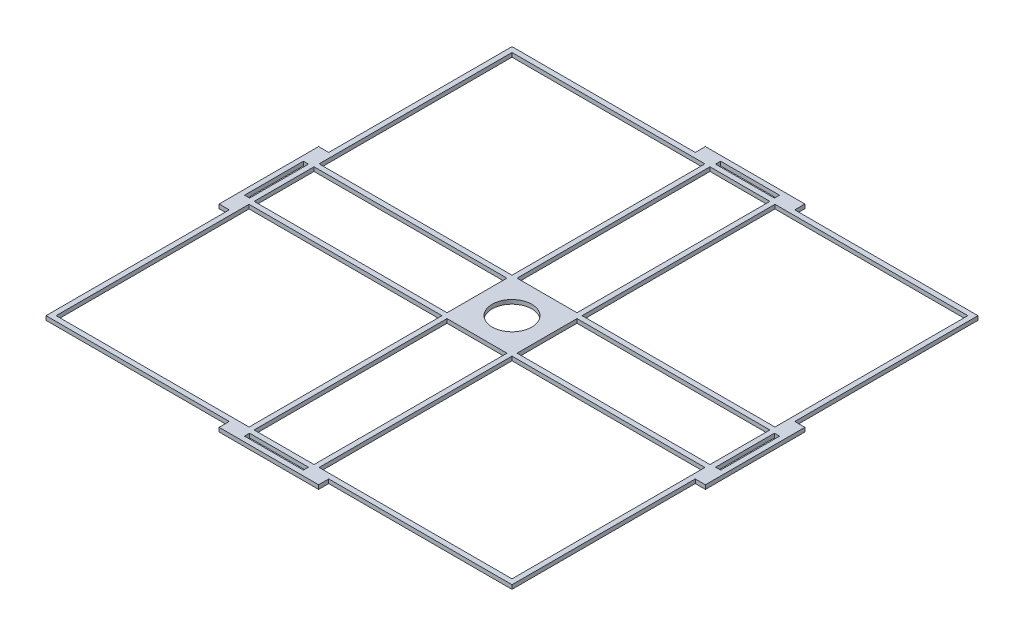
from build123d import *

# Parameters (mm, degrees)
SKETCH1_W           = 22.95
SKETCH1_H           = 22.95
SKETCH1_W_2         = 22.45
SKETCH1_H_2         = 22.45
SKETCH1_W_3         = 0.25
SKETCH1_H_3         = 9.5
SKETCH1_W_4         = 9.5
SKETCH1_H_4         = 0.25
SKETCH1_R           = 0.975
SKETCH1_H_5         = 1
SKETCH1_W_5         = 1
BOSS_EXTRUDE5_DEPTH = 0.2


with BuildPart() as part:
    # Sketch1 → Boss-Extrude5 (new body)
    # profile 1 of 26: a face of its own
    with BuildSketch(Plane(origin=(0, 0, 0), x_dir=(1, 0, 0), z_dir=(0, 1, 0))):
        Rectangle(SKETCH1_W, SKETCH1_H)
        Rectangle(SKETCH1_W_2, SKETCH1_H_2, mode=Mode.SUBTRACT)
    # profile 2 of 26: a face of its own
    with BuildSketch(Plane(origin=(0, 0, 0), x_dir=(1, 0, 0), z_dir=(0, 1, 0))):
        with Locations((-1.6, -6.475)):
            Rectangle(SKETCH1_W_3, SKETCH1_H_3)
    # profile 3 of 26: a face of its own
    with BuildSketch(Plane(origin=(0, 0, 0), x_dir=(1, 0, 0), z_dir=(0, 1, 0))):
        with Locations((-6.475, -1.6)):
            Rectangle(SKETCH1_W_4, SKETCH1_H_4)
    # profile 4 of 26: a face of its own
    with BuildSketch(Plane(origin=(0, 0, 0), x_dir=(1, 0, 0), z_dir=(0, 1, 0))):
        Polygon((-1.475, -1.475), (-1.475, -1.725), (1.475, -1.725), (1.475, -1.475), (1.725, -1.475), (1.725, 1.475), (1.475, 1.475), (1.475, 1.725), (-1.475, 1.725), (-1.475, 1.475), (-1.725, 1.475), (-1.725, -1.475), align=None)
        with Locations(Location((0, 0, 0), (0, 0, 270))):
            Circle(SKETCH1_R, mode=Mode.SUBTRACT)
    # profile 5 of 26: a face of its own
    with BuildSketch(Plane(origin=(0, 0, 0), x_dir=(1, 0, 0), z_dir=(0, 1, 0))):
        with Locations((-1.6, -1.6)):
            Rectangle(SKETCH1_W_3, SKETCH1_H_4)
    # profile 6 of 26: a face of its own
    with BuildSketch(Plane(origin=(0, 0, 0), x_dir=(1, 0, 0), z_dir=(0, 1, 0))):
        with Locations((1.6, -1.6)):
            Rectangle(SKETCH1_W_3, SKETCH1_H_4)
    # profile 7 of 26: a face of its own
    with BuildSketch(Plane(origin=(0, 0, 0), x_dir=(1, 0, 0), z_dir=(0, 1, 0))):
        with Locations((6.475, -1.6)):
            Rectangle(SKETCH1_W_4, SKETCH1_H_4)
    # profile 8 of 26: a face of its own
    with BuildSketch(Plane(origin=(0, 0, 0), x_dir=(1, 0, 0), z_dir=(0, 1, 0))):
        with Locations((1.6, -6.475)):
            Rectangle(SKETCH1_W_3, SKETCH1_H_3)
    # profile 9 of 26: a face of its own
    with BuildSketch(Plane(origin=(0, 0, 0), x_dir=(1, 0, 0), z_dir=(0, 1, 0))):
        with Locations((1.6, 1.6)):
            Rectangle(SKETCH1_W_3, SKETCH1_H_4)
    # profile 10 of 26: a face of its own
    with BuildSketch(Plane(origin=(0, 0, 0), x_dir=(1, 0, 0), z_dir=(0, 1, 0))):
        with Locations((6.475, 1.6)):
            Rectangle(SKETCH1_W_4, SKETCH1_H_4)
    # profile 11 of 26: a face of its own
    with BuildSketch(Plane(origin=(0, 0, 0), x_dir=(1, 0, 0), z_dir=(0, 1, 0))):
        with Locations((1.6, 6.475)):
            Rectangle(SKETCH1_W_3, SKETCH1_H_3)
    # profile 12 of 26: a face of its own
    with BuildSketch(Plane(origin=(0, 0, 0), x_dir=(1, 0, 0), z_dir=(0, 1, 0))):
        with Locations((-1.6, 1.6)):
            Rectangle(SKETCH1_W_3, SKETCH1_H_4)
    # profile 13 of 26: a face of its own
    with BuildSketch(Plane(origin=(0, 0, 0), x_dir=(1, 0, 0), z_dir=(0, 1, 0))):
        with Locations((-6.475, 1.6)):
            Rectangle(SKETCH1_W_4, SKETCH1_H_4)
    # profile 14 of 26: a face of its own
    with BuildSketch(Plane(origin=(0, 0, 0), x_dir=(1, 0, 0), z_dir=(0, 1, 0))):
        with Locations((-1.6, 6.475)):
            Rectangle(SKETCH1_W_3, SKETCH1_H_3)
    # profile 15 of 26: a face of its own
    with BuildSketch(Plane(origin=(0, 0, 0), x_dir=(1, 0, 0), z_dir=(0, 1, 0))):
        with Locations((-11.6, -1.95)):
            Rectangle(SKETCH1_W_3, SKETCH1_H_5)
    # profile 16 of 26: a face of its own
    with BuildSketch(Plane(origin=(0, 0, 0), x_dir=(1, 0, 0), z_dir=(0, 1, 0))):
        with Locations((-11.6, 1.95)):
            Rectangle(SKETCH1_W_3, SKETCH1_H_5)
    # profile 17 of 26: a face of its own
    with BuildSketch(Plane(origin=(0, 0, 0), x_dir=(1, 0, 0), z_dir=(0, 1, 0))):
        with Locations((11.6, -1.95)):
            Rectangle(SKETCH1_W_3, SKETCH1_H_5)
    # profile 18 of 26: a face of its own
    with BuildSketch(Plane(origin=(0, 0, 0), x_dir=(1, 0, 0), z_dir=(0, 1, 0))):
        with Locations((11.6, 1.95)):
            Rectangle(SKETCH1_W_3, SKETCH1_H_5)
    # profile 19 of 26: a face of its own
    with BuildSketch(Plane(origin=(0, 0, 0), x_dir=(1, 0, 0), z_dir=(0, 1, 0))):
        with Locations((1.95, -11.6)):
            Rectangle(SKETCH1_W_5, SKETCH1_H_4)
    # profile 20 of 26: a face of its own
    with BuildSketch(Plane(origin=(0, 0, 0), x_dir=(1, 0, 0), z_dir=(0, 1, 0))):
        with Locations((-1.95, -11.6)):
            Rectangle(SKETCH1_W_5, SKETCH1_H_4)
    # profile 21 of 26: a face of its own
    with BuildSketch(Plane(origin=(0, 0, 0), x_dir=(1, 0, 0), z_dir=(0, 1, 0))):
        with Locations((1.95, 11.6)):
            Rectangle(SKETCH1_W_5, SKETCH1_H_4)
    # profile 22 of 26: a face of its own
    with BuildSketch(Plane(origin=(0, 0, 0), x_dir=(1, 0, 0), z_dir=(0, 1, 0))):
        with Locations((-1.95, 11.6)):
            Rectangle(SKETCH1_W_5, SKETCH1_H_4)
    # profile 23 of 26: a face of its own
    with BuildSketch(Plane(origin=(0, 0, 0), x_dir=(1, 0, 0), z_dir=(0, 1, 0))):
        Polygon((-11.975, -2.45), (-11.725, -2.45), (-11.725, -1.45), (-11.725, 1.45), (-11.725, 2.45), (-11.975, 2.45), align=None)
    # profile 24 of 26: a face of its own
    with BuildSketch(Plane(origin=(0, 0, 0), x_dir=(1, 0, 0), z_dir=(0, 1, 0))):
        Polygon((2.45, -11.975), (2.45, -11.725), (1.45, -11.725), (-1.45, -11.725), (-2.45, -11.725), (-2.45, -11.975), align=None)
    # profile 25 of 26: a face of its own
    with BuildSketch(Plane(origin=(0, 0, 0), x_dir=(1, 0, 0), z_dir=(0, 1, 0))):
        Polygon((11.725, -1.45), (11.725, -2.45), (11.975, -2.45), (11.975, 2.45), (11.725, 2.45), (11.725, 1.45), align=None)
    # profile 26 of 26: a face of its own
    with BuildSketch(Plane(origin=(0, 0, 0), x_dir=(1, 0, 0), z_dir=(0, 1, 0))):
        Polygon((1.45, 11.725), (2.45, 11.725), (2.45, 11.975), (-2.45, 11.975), (-2.45, 11.725), (-1.45, 11.725), align=None)
    extrude(amount=BOSS_EXTRUDE5_DEPTH)


solid = part.part
